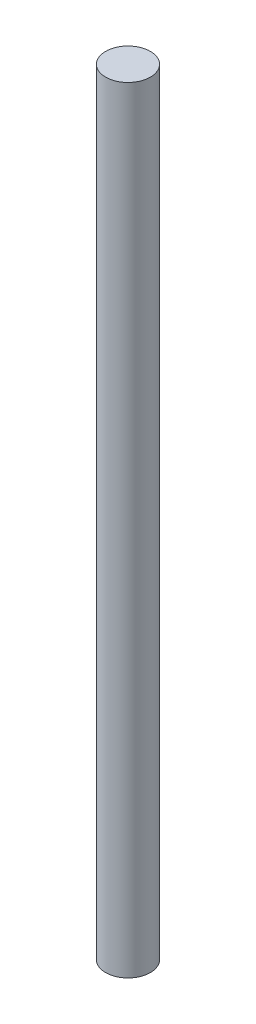
from build123d import *

# Parameters (mm, degrees)
SCALE1_SCALE_X = 1.07
SCALE1_SCALE_Y = 1.01
SCALE1_SCALE_Z = 1.07


with BuildPart() as part:
    # Sketch2 → Revolve1 (revolve)
    with BuildSketch(Plane.XY):
        Polygon((0, 84.55), (0, 60.65), (0, -60.65), (3.95, -60.65), (3.95, 84.55), align=None)
    revolve(axis=Axis((0, 24.52235385, 0), (0, -1, 0)))


with BuildPart() as part_1:
    # Scale1: scaled about (0, 0, 0)
    add(part.part.scale((SCALE1_SCALE_X, SCALE1_SCALE_Y, SCALE1_SCALE_Z), about=(0, 0, 0)))


solid = part_1.part
